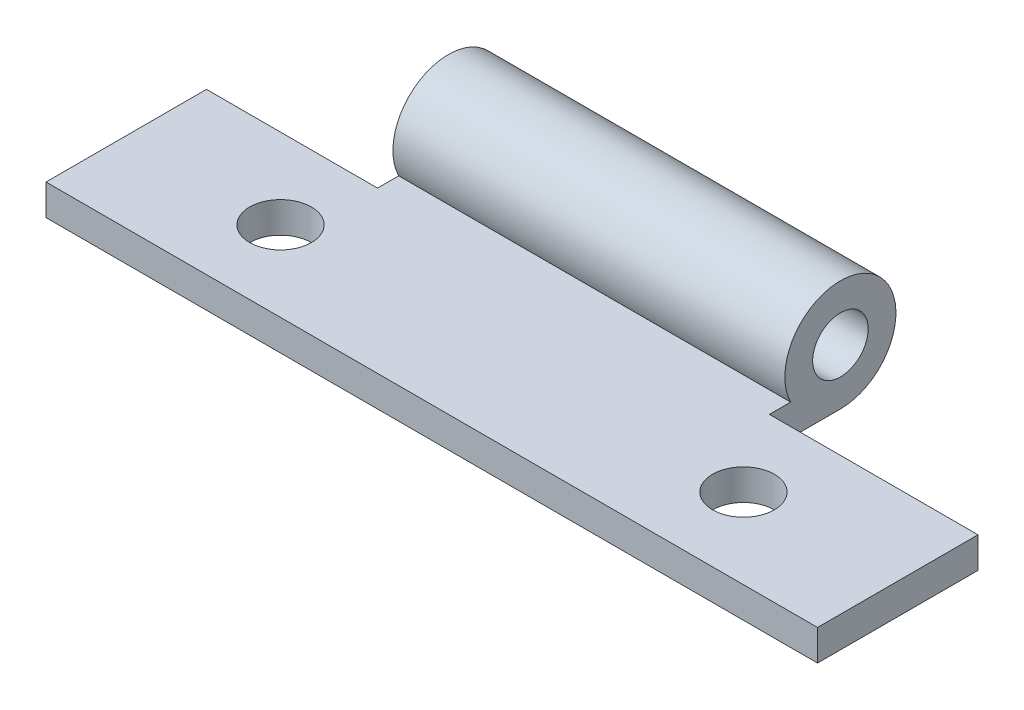
from build123d import *

# Parameters (mm, degrees)
SKETCH1_R               = 0.9
BOSS_EXTRUDE1_DEPTH     = 25
CUT_EXTRUDE1_DEPTH      = 25
CUT_EXTRUDE1_DEPTH_BACK = 25
SKETCH2_W               = 5.541335726
SKETCH2_H               = 4.1
SKETCH2_W_2             = 6.758664274
CUT_EXTRUDE2_DEPTH      = 25
CUT_EXTRUDE2_DEPTH_BACK = 25
SKETCH3_R               = 1


with BuildPart() as part:
    # Sketch1 → Boss-Extrude1 (new body)
    with BuildSketch(Plane(origin=(0, 0, 0), x_dir=(0, 0, -1), z_dir=(1, 0, 0))):
        with BuildLine():
            Line((-6.797691641, -1.201831935), (-14.297691641, -1.201831935))
            Line((-14.297691641, -1.201831935), (-14.297691641, -0.201831935))
            Line((-14.297691641, -0.201831935), (-8.410143191, -0.201831935))
            ThreePointArc((-8.410143191, -0.201831935), (-5.849008343, 2.127873919), (-6.797691641, -1.201831935))
        make_face()
        with Locations((-6.797691641, 0.598168065)):
            Circle(SKETCH1_R, mode=Mode.SUBTRACT)
    extrude(amount=BOSS_EXTRUDE1_DEPTH)

    # Sketch2 → Cut-Extrude1 (cut, two sides: drawn at the far end of the back side and taken through both)
    with BuildSketch(Plane(origin=(0, 0, 0), x_dir=(1, 0, 0), z_dir=(0, 1, 0)).offset(-CUT_EXTRUDE1_DEPTH_BACK)):
        with Locations((2.770667863, -7.047691641)):
            Rectangle(SKETCH2_W, SKETCH2_H)
        with Locations((21.620667863, -7.047691641)):
            Rectangle(SKETCH2_W_2, SKETCH2_H)
    extrude(amount=CUT_EXTRUDE1_DEPTH + CUT_EXTRUDE1_DEPTH_BACK, mode=Mode.SUBTRACT)

    # Sketch3 → Cut-Extrude2 (cut, two sides: drawn at the far end of the back side and taken through both)
    with BuildSketch(Plane(origin=(0, -0.201831935, 0), x_dir=(1, 0, 0), z_dir=(0, 1, 0)).offset(-CUT_EXTRUDE2_DEPTH_BACK)):
        with Locations((5, -11.697691641)):
            Circle(SKETCH3_R)
        with Locations((20, -11.697691641)):
            Circle(SKETCH3_R)
    extrude(amount=CUT_EXTRUDE2_DEPTH + CUT_EXTRUDE2_DEPTH_BACK, mode=Mode.SUBTRACT)


solid = part.part
